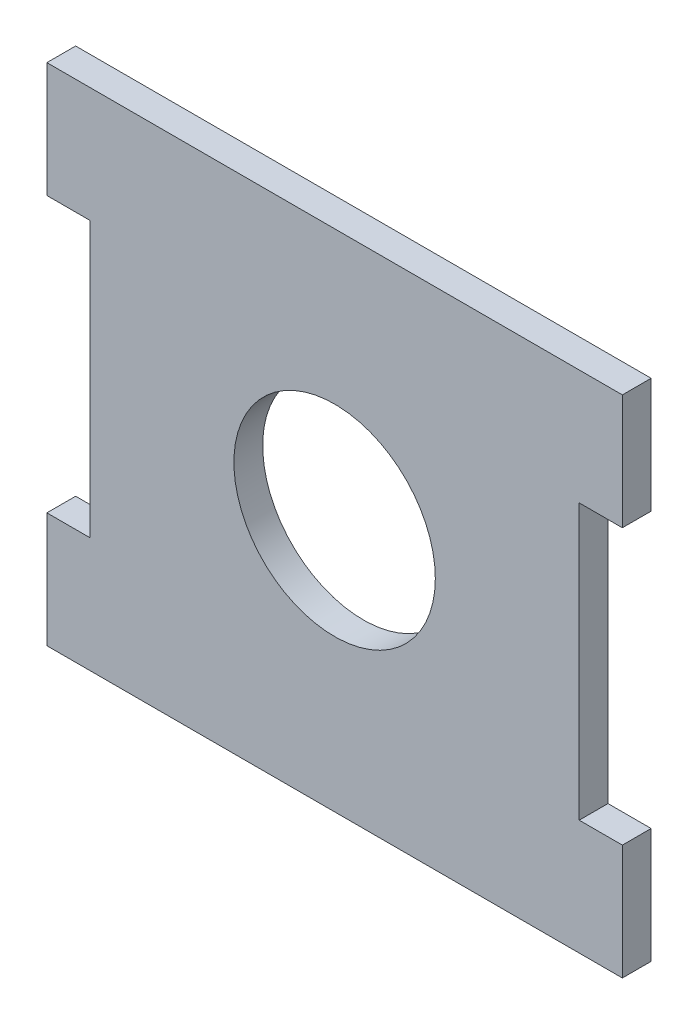
from build123d import *

# Parameters (mm, degrees)
SKETCH_1_R      = 7
EXTRUDE_1_DEPTH = 2


with BuildPart() as part:
    # 草图1 → 凸台-拉伸1 (new body)
    with BuildSketch(Plane.XY):
        Polygon((0, 0), (3, 0), (3, -8), (0, -8), (0, -27.1), (3, -27.1), (3, -35.1), (0, -35.1), (-34, -35.1), (-37, -35.1), (-37, -27.1), (-34, -27.1), (-34, -8), (-37, -8), (-37, 0), (-34, 0), align=None)
        with Locations((-17, -17.55)):
            Circle(SKETCH_1_R, mode=Mode.SUBTRACT)
    extrude(amount=EXTRUDE_1_DEPTH)


solid = part.part
